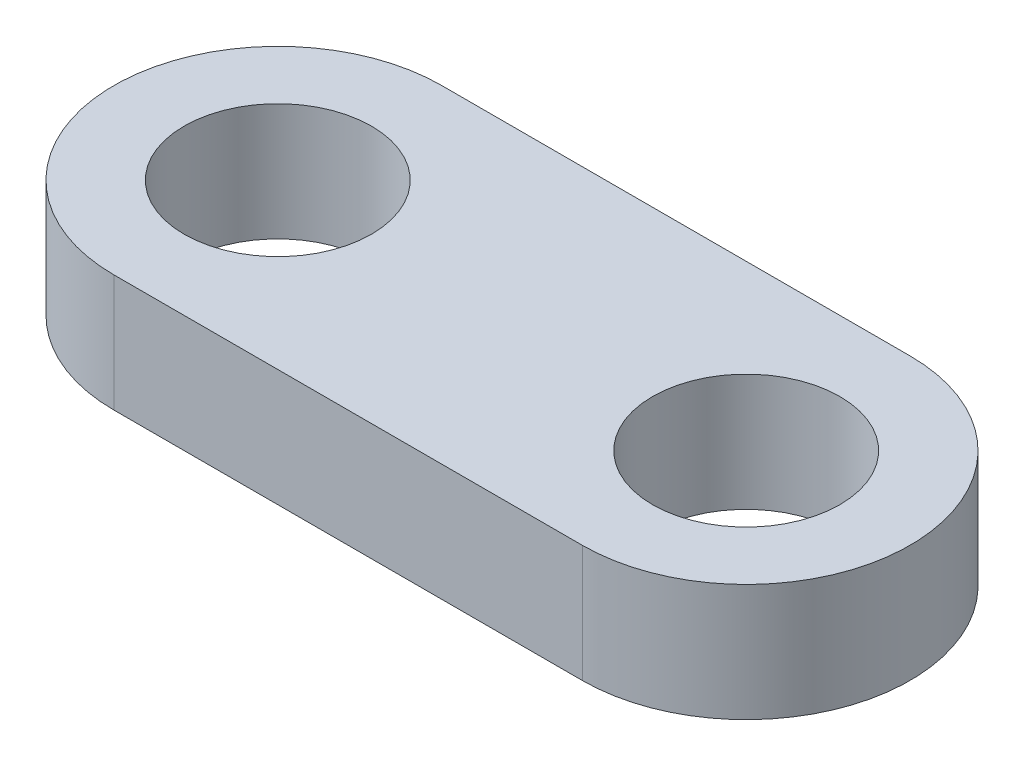
from build123d import *

# Parameters (mm, degrees)
SKETCH1_R           = 4
BOSS_EXTRUDE1_DEPTH = 5


with BuildPart() as part:
    # Sketch1 → Boss-Extrude1 (new body)
    with BuildSketch(Plane(origin=(0, 0, 0), x_dir=(1, 0, 0), z_dir=(0, 1, 0))):
        with BuildLine():
            Line((-10, 7), (10, 7))
            ThreePointArc((10, 7), (17, 0), (10, -7))
            Line((10, -7), (-10, -7))
            ThreePointArc((-10, -7), (-17, 0), (-10, 7))
        make_face()
        with Locations(Location((-10, 0, 0), (0, 0, 270))):
            Circle(SKETCH1_R, mode=Mode.SUBTRACT)
        with Locations(Location((10, 0, 0), (0, 0, 270))):
            Circle(SKETCH1_R, mode=Mode.SUBTRACT)
    extrude(amount=BOSS_EXTRUDE1_DEPTH)


solid = part.part
